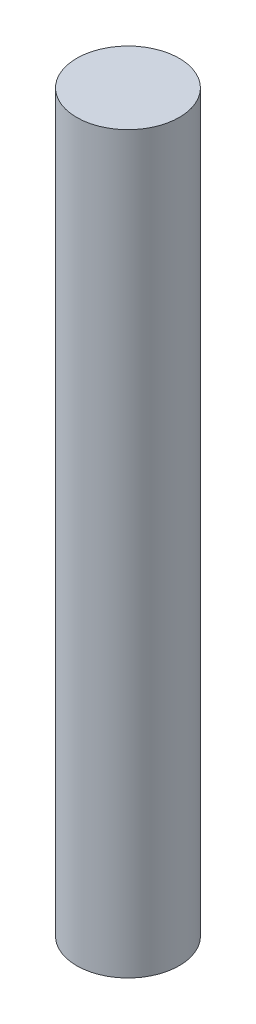
from build123d import *

# Parameters (mm, degrees)
SKETCH_1_R      = 1.5
EXTRUDE_1_DEPTH = 21.5


with BuildPart() as part:
    # 草图1 → 凸台-拉伸1 (new body)
    with BuildSketch(Plane(origin=(0, 0, 0), x_dir=(1, 0, 0), z_dir=(0, 1, 0))):
        with Locations(Location((0, 0, 0), (0, 0, 270))):
            Circle(SKETCH_1_R)
    extrude(amount=EXTRUDE_1_DEPTH)


solid = part.part
